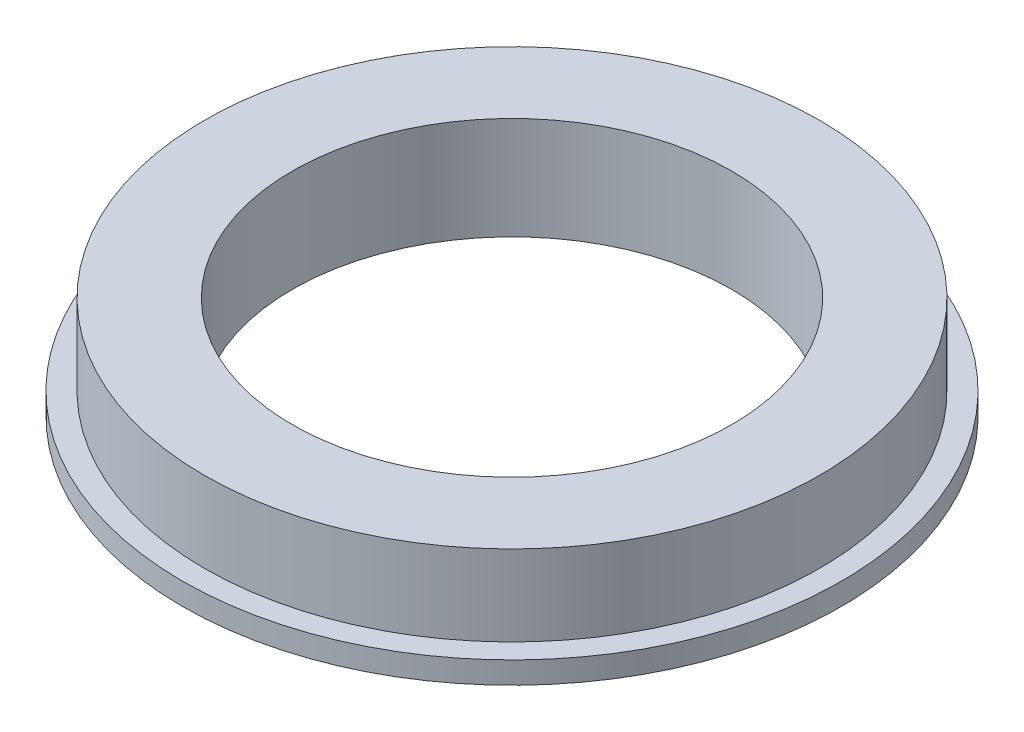
from build123d import *


with BuildPart() as part:
    # 草图1 → 旋转1 (revolve)
    with BuildSketch(Plane.XY, mode=Mode.PRIVATE) as revolve_1_sk:
        Polygon((-15, 0), (-15, 7), (-21, 7), (-21, 1.5), (-22.5, 1.5), (-22.5, 0), align=None)
    revolve(revolve_1_sk.sketch.rotate(Axis((0, 0, 0), (0, 1, 0)), 270), axis=Axis((0, 0, 0), (0, 1, 0)))


solid = part.part
